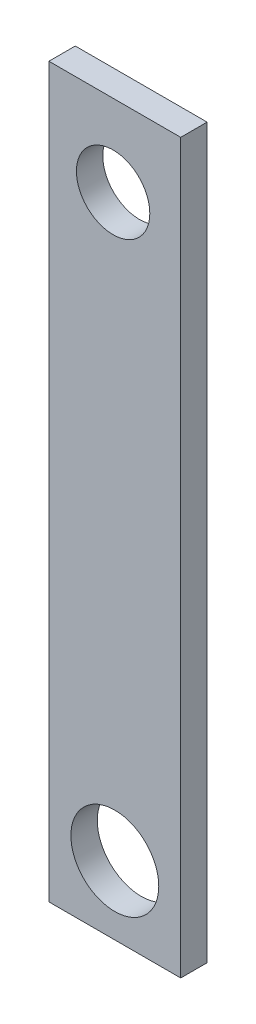
from build123d import *

# Parameters (mm, degrees)
SKETCH1_W           = 15
SKETCH1_H           = 82.851126945
SKETCH1_R           = 5
SKETCH1_R_2         = 4.176866713
BOSS_EXTRUDE1_DEPTH = 3


with BuildPart() as part:
    # Sketch1 → Boss-Extrude1 (new body)
    with BuildSketch(Plane.XY):
        with Locations((-11.055414447, -59.657521602)):
            Rectangle(SKETCH1_W, SKETCH1_H)
        with Locations((-11.055414447, -93.28694347)):
            Circle(SKETCH1_R, mode=Mode.SUBTRACT)
        with Locations((-11.25, -27.5)):
            Circle(SKETCH1_R_2, mode=Mode.SUBTRACT)
    extrude(amount=BOSS_EXTRUDE1_DEPTH)


solid = part.part
